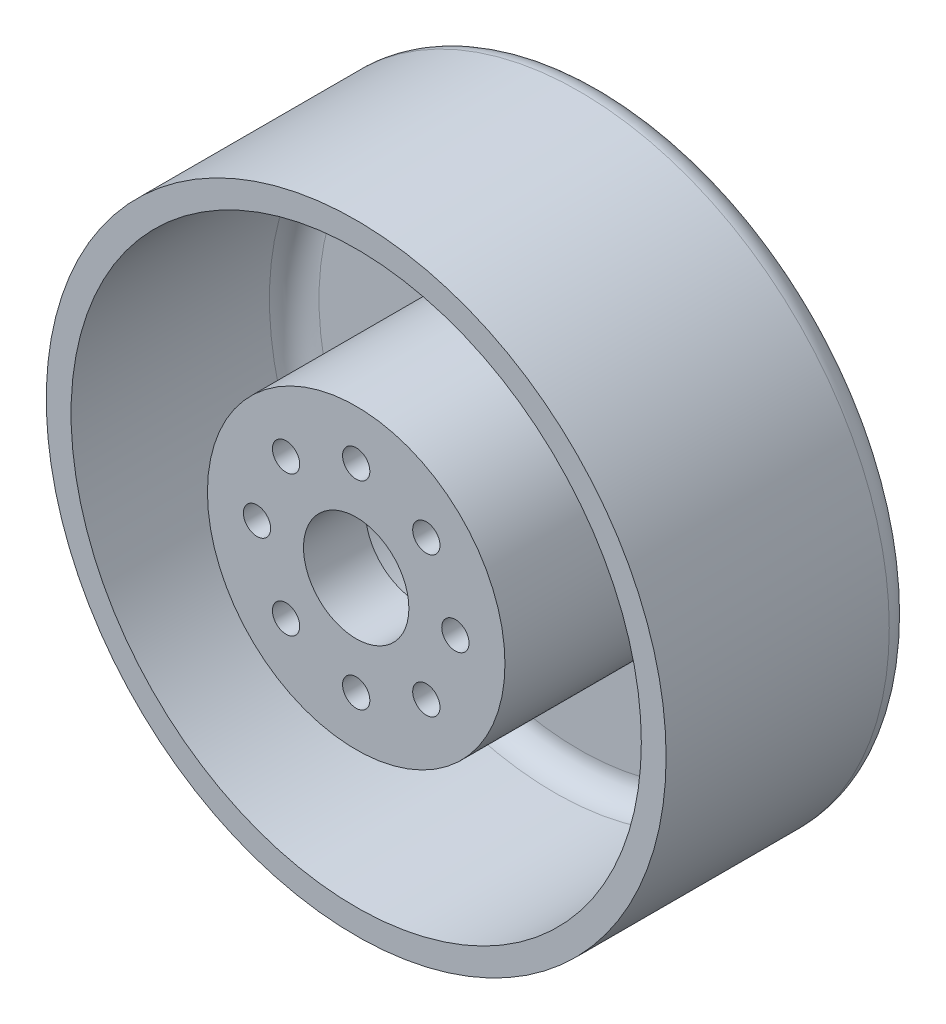
from build123d import *

# Parameters (mm, degrees)
SKETCH1_R                      = 25
BOSS_EXTRUDE1_DEPTH            = 20
SKETCH4_R                      = 11
CUT_EXTRUDE1_DEPTH             = 15
CBORE_FOR_M2_SHCS2_D           = 2.2
CBORE_FOR_M2_SHCS2_CBORE_D     = 4.4
CBORE_FOR_M2_SHCS2_CBORE_DEPTH = 2
SKETCH7_R                      = 23
SKETCH7_R_2                    = 12
CUT_EXTRUDE2_DEPTH             = 18
FILLET1_R                      = 2
SKETCH8_R                      = 4.25
CUT_EXTRUDE3_DEPTH             = 18


with BuildPart() as part:
    # Sketch1 → Boss-Extrude1 (new body)
    with BuildSketch(Plane.XY):
        Circle(SKETCH1_R)
    extrude(amount=BOSS_EXTRUDE1_DEPTH)

    # Sketch4 → Cut-Extrude1 (cut)
    with BuildSketch(Plane(origin=(0, 0, 0), x_dir=(-1, 0, 0), z_dir=(0, 0, -1))):
        Circle(SKETCH4_R)
    extrude(amount=-CUT_EXTRUDE1_DEPTH, mode=Mode.SUBTRACT)

    # CBORE for M2 SHCS2 (through all)
    with Locations(Plane(origin=(0, 0, 15), x_dir=(-1, 0, 0), z_dir=(0, 0, -1))):
        with Locations((0, 8), (5.656854249, 5.656854249), (8, 0), (5.656854249, -5.656854249), (0, -8), (-5.656854249, -5.656854249), (-8, 0), (-5.656854249, 5.656854249)):
            CounterBoreHole(CBORE_FOR_M2_SHCS2_D / 2, CBORE_FOR_M2_SHCS2_CBORE_D / 2, CBORE_FOR_M2_SHCS2_CBORE_DEPTH)

    # Sketch7 → Cut-Extrude2 (cut)
    with BuildSketch(Plane.XY.offset(20)):
        Circle(SKETCH7_R)
        Circle(SKETCH7_R_2, mode=Mode.SUBTRACT)
    extrude(amount=-CUT_EXTRUDE2_DEPTH, mode=Mode.SUBTRACT)

    # Fillet1
    fillet1_edges = [part.edges().sort_by_distance(p)[0] for p in [
        (-25, 0, 0),
        (11, 0, 0),
        (-23, 0, 2),
    ]]
    fillet(fillet1_edges, radius=FILLET1_R)

    # Sketch8 → Cut-Extrude3 (cut)
    with BuildSketch(Plane.XY.offset(20)):
        Circle(SKETCH8_R)
    extrude(amount=-CUT_EXTRUDE3_DEPTH, mode=Mode.SUBTRACT)


solid = part.part
